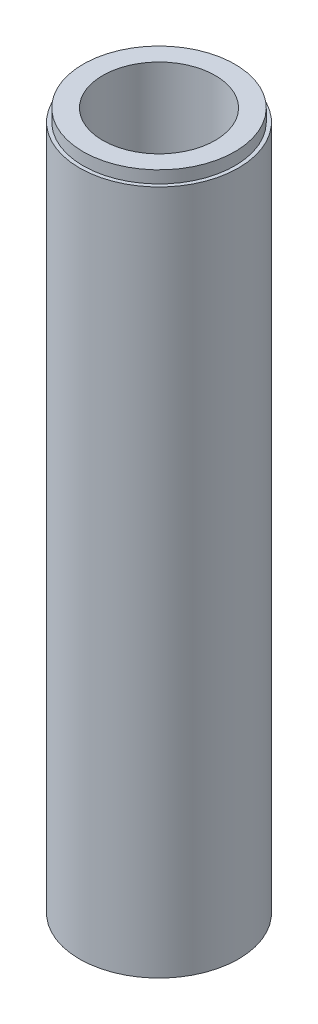
from build123d import *

# Parameters (mm, degrees)
SKETCH_1_R      = 3.25
SKETCH_1_R_2    = 2.3
EXTRUDE_1_DEPTH = 28
SKETCH_2_R      = 3.1
SKETCH_2_R_2    = 2.3
EXTRUDE_2_DEPTH = 0.5


with BuildPart() as part:
    # Эскиз1 → Бобышка-Вытянуть1 (new body)
    with BuildSketch(Plane(origin=(0, 0, 0), x_dir=(1, 0, 0), z_dir=(0, 1, 0))):
        with Locations(Location((0, 0, 0), (0, 0, 270))):
            Circle(SKETCH_1_R)
        with Locations(Location((0, 0, 0), (0, 0, 270))):
            Circle(SKETCH_1_R_2, mode=Mode.SUBTRACT)
    extrude(amount=EXTRUDE_1_DEPTH)

    # Эскиз2 → Бобышка-Вытянуть2 (add)
    with BuildSketch(Plane(origin=(0, 28, 0), x_dir=(1, 0, 0), z_dir=(0, 1, 0))):
        with Locations(Location((0, 0, 0), (0, 0, 270))):
            Circle(SKETCH_2_R)
        with Locations(Location((0, 0, 0), (0, 0, 270))):
            Circle(SKETCH_2_R_2, mode=Mode.SUBTRACT)
    extrude(amount=EXTRUDE_2_DEPTH)


solid = part.part
